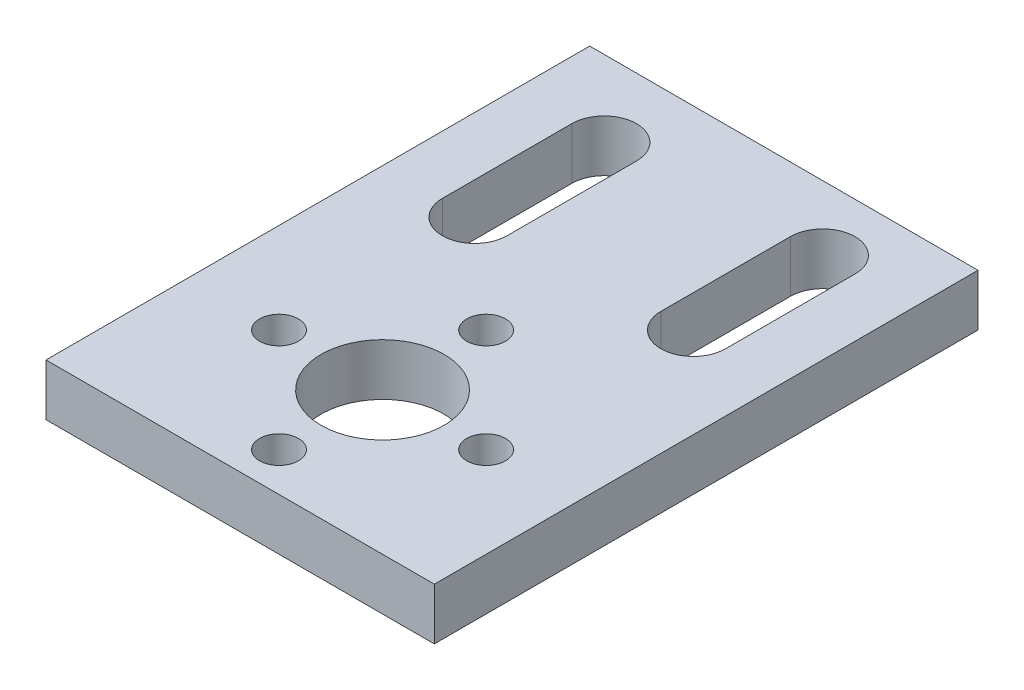
from build123d import *

# Parameters (mm, degrees)
SKETCH_1_W      = 30
SKETCH_1_H      = 42
SKETCH_1_R      = 4.75
SKETCH_1_R_2    = 1.5
EXTRUDE_1_DEPTH = 4


with BuildPart() as part:
    # 草图1 → 凸台-拉伸1 (new body)
    with BuildSketch(Plane(origin=(0, 0, 0), x_dir=(1, 0, 0), z_dir=(0, 1, 0))):
        with Locations((0, -1)):
            Rectangle(SKETCH_1_W, SKETCH_1_H)
        with Locations(Location((0, -11, 0), (0, 0, 270))):
            Circle(SKETCH_1_R, mode=Mode.SUBTRACT)
        with Locations(Location((0, -3, 0), (0, 0, 270))):
            Circle(SKETCH_1_R_2, mode=Mode.SUBTRACT)
        with Locations(Location((8, -11, 0), (0, 0, 270))):
            Circle(SKETCH_1_R_2, mode=Mode.SUBTRACT)
        with Locations(Location((0, -19, 0), (0, 0, 270))):
            Circle(SKETCH_1_R_2, mode=Mode.SUBTRACT)
        with Locations(Location((-8, -11, 0), (0, 0, 270))):
            Circle(SKETCH_1_R_2, mode=Mode.SUBTRACT)
        with BuildLine():
            Line((-10.5, 14.11842029), (-10.5, 4.11842029))
            ThreePointArc((-10.5, 4.11842029), (-8, 1.61842029), (-5.5, 4.11842029))
            Line((-5.5, 4.11842029), (-5.5, 14.11842029))
            ThreePointArc((-5.5, 14.11842029), (-8, 16.61842029), (-10.5, 14.11842029))
        make_face(mode=Mode.SUBTRACT)
        with BuildLine():
            Line((5.5, 15), (5.5, 5))
            ThreePointArc((5.5, 5), (8, 2.5), (10.5, 5))
            Line((10.5, 5), (10.5, 15))
            ThreePointArc((10.5, 15), (8, 17.5), (5.5, 15))
        make_face(mode=Mode.SUBTRACT)
    extrude(amount=EXTRUDE_1_DEPTH)


solid = part.part
